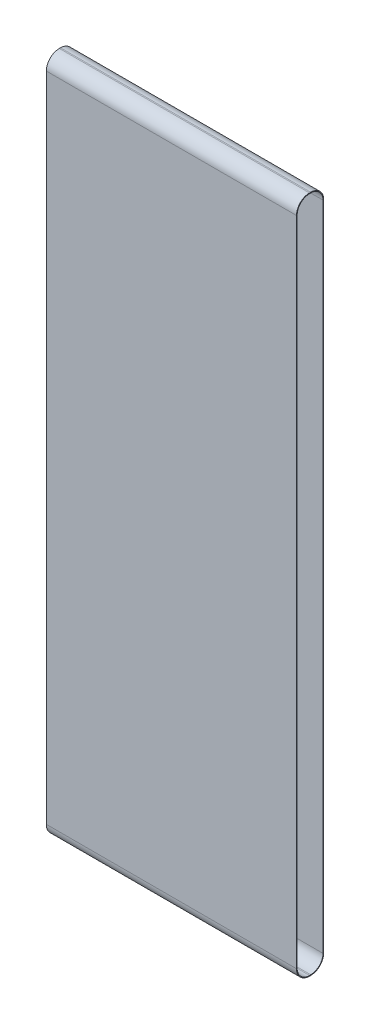
from build123d import *

# Parameters (mm, degrees)
SKETCH1_W           = 482.6
SKETCH1_H           = 52.578
BOSS_EXTRUDE1_DEPTH = 1308.608
FILLET1_R           = 25.1206
CUT_EXTRUDE1_DEPTH  = 1396.008519395


with BuildPart() as part:
    # Sketch1 → Boss-Extrude1 (new body)
    with BuildSketch(Plane(origin=(0, 0, 0), x_dir=(1, 0, 0), z_dir=(0, 1, 0))):
        Rectangle(SKETCH1_W, SKETCH1_H)
    extrude(amount=BOSS_EXTRUDE1_DEPTH)

    # Fillet1
    fillet1_edges = [part.edges().sort_by_distance(p)[0] for p in [
        (0, 1308.608, -26.289),
        (0, 0, -26.289),
        (0, 0, 26.289),
        (0, 1308.608, 26.289),
    ]]
    fillet(fillet1_edges, radius=FILLET1_R)

    # Sketch2 → Cut-Extrude1 (cut, through all)
    with BuildSketch(Plane(origin=(241.3, 0, 0), x_dir=(0, 0, -1), z_dir=(1, 0, 0))):
        with BuildLine():
            Line((24.9428, 25.1206), (24.9428, 1283.4874))
            ThreePointArc((24.9428, 1283.4874), (17.979439459, 1300.298439459), (1.1684, 1307.2618))
            Line((1.1684, 1307.2618), (-1.1684, 1307.2618))
            ThreePointArc((-1.1684, 1307.2618), (-17.979439459, 1300.298439459), (-24.9428, 1283.4874))
            Line((-24.9428, 1283.4874), (-24.9428, 25.1206))
            ThreePointArc((-24.9428, 25.1206), (-17.979439459, 8.309560541), (-1.1684, 1.3462))
            Line((-1.1684, 1.3462), (1.1684, 1.3462))
            ThreePointArc((1.1684, 1.3462), (17.979439459, 8.309560541), (24.9428, 25.1206))
        make_face()
    extrude(amount=-CUT_EXTRUDE1_DEPTH, mode=Mode.SUBTRACT)


solid = part.part
